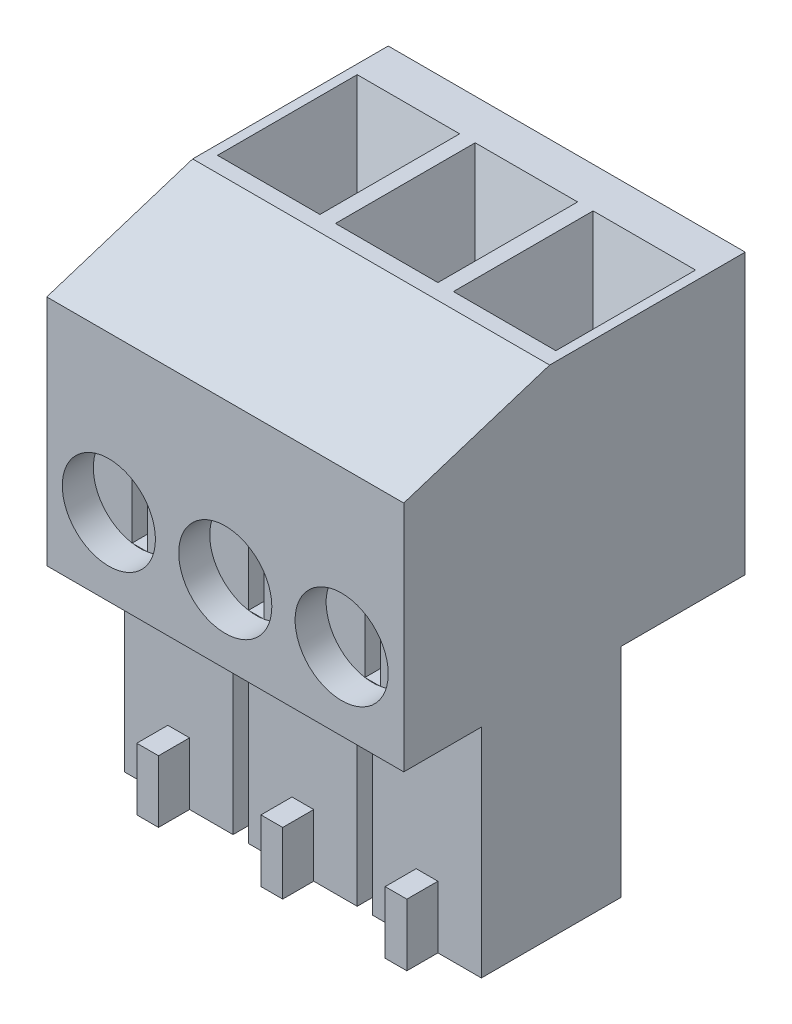
from build123d import *

# Parameters (mm, degrees)
SKETCH1_W                    = 11.5
SKETCH1_H                    = 11
BOSS_EXTRUDE1_DEPTH          = 9
SKETCH2_W                    = 3.5
SKETCH2_H                    = 4.5
BOSS_EXTRUDE2_DEPTH          = 7
SKETCH3_W                    = 3.3
SKETCH3_H                    = 4.5
CUT_EXTRUDE1_DEPTH           = 3
CUT_EXTRUDE1_DRAFT           = -15
CUT_EXTRUDE1_PROFILE_2_DEPTH = 3
CUT_EXTRUDE1_PROFILE_2_DRAFT = -15
CUT_EXTRUDE1_PROFILE_3_DEPTH = 3
CUT_EXTRUDE1_PROFILE_3_DRAFT = -15
SKETCH4_W                    = 1.692304846
SKETCH4_H                    = 2.892304846
CUT_EXTRUDE2_DEPTH           = 3
CUT_EXTRUDE3_DEPTH           = 17
SKETCH6_R                    = 1.5
CUT_EXTRUDE4_DEPTH           = 1
SKETCH7_W                    = 0.5
SKETCH7_H                    = 2.958039891
CUT_EXTRUDE5_DEPTH           = 0.5
SKETCH8_W                    = 0.7
SKETCH8_H                    = 2
BOSS_EXTRUDE3_DEPTH          = 1


with BuildPart() as part:
    # Sketch1 → Boss-Extrude1 (new body)
    with BuildSketch(Plane(origin=(0, 0, 0), x_dir=(1, 0, 0), z_dir=(0, 1, 0))):
        Rectangle(SKETCH1_W, SKETCH1_H)
    extrude(amount=BOSS_EXTRUDE1_DEPTH)

    # Sketch2 → Boss-Extrude2 (add)
    with BuildSketch(Plane.XZ):
        with Locations((-4, 0.75)):
            Rectangle(SKETCH2_W, SKETCH2_H)
        with Locations((4, 0.75)):
            Rectangle(SKETCH2_W, SKETCH2_H)
        with Locations((0, 0.75)):
            Rectangle(SKETCH2_W, SKETCH2_H)
    extrude(amount=BOSS_EXTRUDE2_DEPTH)


with BuildPart() as cut_extrude1_tool:
    # Sketch3 → Cut-Extrude1 (with draft: the straight prism first)
    with BuildSketch(Plane(origin=(0, 9, 0), x_dir=(1, 0, 0), z_dir=(0, 1, 0))):
        with Locations((3.8, 1.95)):
            Rectangle(SKETCH3_W, SKETCH3_H)
    extrude(amount=-CUT_EXTRUDE1_DEPTH)
    # Cut-Extrude1: the draft: its side faces are tilted about the plane it starts from
    cut_extrude1_sides = [cut_extrude1_tool.faces().sort_by_distance(p)[0] for p in [
        (3.8, 7.5, -4.2),
        (2.15, 7.5, -1.95),
        (3.8, 7.5, 0.3),
        (5.45, 7.5, -1.95),
    ]]
    draft(cut_extrude1_sides, Plane(origin=(0, 9, 0), x_dir=(1, 0, 0), z_dir=(0, 1, 0)), CUT_EXTRUDE1_DRAFT)


with BuildPart() as part_1:
    add(part.part)

    # Cut-Extrude1: cut by cut_extrude1_tool
    add(cut_extrude1_tool.part, mode=Mode.SUBTRACT)


with BuildPart() as cut_extrude1_profile_2_tool:
    # Sketch3 → Cut-Extrude1 profile 2 (with draft: the straight prism first)
    with BuildSketch(Plane(origin=(0, 9, 0), x_dir=(1, 0, 0), z_dir=(0, 1, 0))):
        with Locations((-3.8, 1.95)):
            Rectangle(SKETCH3_W, SKETCH3_H)
    extrude(amount=-CUT_EXTRUDE1_PROFILE_2_DEPTH)
    # Cut-Extrude1 profile 2: the draft: its side faces are tilted about the plane it starts from
    cut_extrude1_profile_2_sides = [cut_extrude1_profile_2_tool.faces().sort_by_distance(p)[0] for p in [
        (-3.8, 7.5, -4.2),
        (-5.45, 7.5, -1.95),
        (-3.8, 7.5, 0.3),
        (-2.15, 7.5, -1.95),
    ]]
    draft(cut_extrude1_profile_2_sides, Plane(origin=(0, 9, 0), x_dir=(1, 0, 0), z_dir=(0, 1, 0)), CUT_EXTRUDE1_PROFILE_2_DRAFT)


with BuildPart() as part_2:
    add(part_1.part)

    # Cut-Extrude1 profile 2: cut by cut_extrude1_profile_2_tool
    add(cut_extrude1_profile_2_tool.part, mode=Mode.SUBTRACT)


with BuildPart() as cut_extrude1_profile_3_tool:
    # Sketch3 → Cut-Extrude1 profile 3 (with draft: the straight prism first)
    with BuildSketch(Plane(origin=(0, 9, 0), x_dir=(1, 0, 0), z_dir=(0, 1, 0))):
        with Locations((0, 1.95)):
            Rectangle(SKETCH3_W, SKETCH3_H)
    extrude(amount=-CUT_EXTRUDE1_PROFILE_3_DEPTH)
    # Cut-Extrude1 profile 3: the draft: its side faces are tilted about the plane it starts from
    cut_extrude1_profile_3_sides = [cut_extrude1_profile_3_tool.faces().sort_by_distance(p)[0] for p in [
        (-1.65, 7.5, -1.95),
        (0, 7.5, 0.3),
        (1.65, 7.5, -1.95),
        (0, 7.5, -4.2),
    ]]
    draft(cut_extrude1_profile_3_sides, Plane(origin=(0, 9, 0), x_dir=(1, 0, 0), z_dir=(0, 1, 0)), CUT_EXTRUDE1_PROFILE_3_DRAFT)


with BuildPart() as part_3:
    add(part_2.part)

    # Cut-Extrude1 profile 3: cut by cut_extrude1_profile_3_tool
    add(cut_extrude1_profile_3_tool.part, mode=Mode.SUBTRACT)

    # Sketch4 → Cut-Extrude2 (cut)
    with BuildSketch(Plane(origin=(0, 6, 0), x_dir=(1, 0, 0), z_dir=(0, 1, 0))):
        with Locations((-3.8, 1.95)):
            Rectangle(SKETCH4_W, SKETCH4_H)
        with Locations((3.8, 1.95)):
            Rectangle(SKETCH4_W, SKETCH4_H)
        with Locations((0, 1.95)):
            Rectangle(SKETCH4_W, SKETCH4_H)
    extrude(amount=-CUT_EXTRUDE2_DEPTH, mode=Mode.SUBTRACT)

    # Sketch5 → Cut-Extrude3 (cut)
    with BuildSketch(Plane.ZY.offset(5.75)):
        Polygon((5.5, 9), (0.8, 9), (5.5, 7.5), align=None)
    extrude(amount=-CUT_EXTRUDE3_DEPTH, mode=Mode.SUBTRACT)

    # Sketch6 → Cut-Extrude4 (cut)
    with BuildSketch(Plane.XY.offset(5.5)):
        with Locations((-3.75, 2.487199689)):
            Circle(SKETCH6_R)
        with Locations((0, 2.487199689)):
            Circle(SKETCH6_R)
        with Locations((3.75, 2.487199689)):
            Circle(SKETCH6_R)
    extrude(amount=-CUT_EXTRUDE4_DEPTH, mode=Mode.SUBTRACT)

    # Sketch7 → Cut-Extrude5 (cut)
    with BuildSketch(Plane.XY.offset(4.5)):
        with Locations((-3.75, 2.487199689)):
            Rectangle(SKETCH7_W, SKETCH7_H)
        with Locations((0, 2.487199689)):
            Rectangle(SKETCH7_W, SKETCH7_H)
        with Locations((3.75, 2.487199689)):
            Rectangle(SKETCH7_W, SKETCH7_H)
    extrude(amount=-CUT_EXTRUDE5_DEPTH, mode=Mode.SUBTRACT)

    # Sketch8 → Boss-Extrude3 (add)
    with BuildSketch(Plane.XY.offset(3)):
        with Locations((4, -6)):
            Rectangle(SKETCH8_W, SKETCH8_H)
        with Locations((-4, -6)):
            Rectangle(SKETCH8_W, SKETCH8_H)
        with Locations((0, -6)):
            Rectangle(SKETCH8_W, SKETCH8_H)
    extrude(amount=BOSS_EXTRUDE3_DEPTH)


solid = part_3.part
